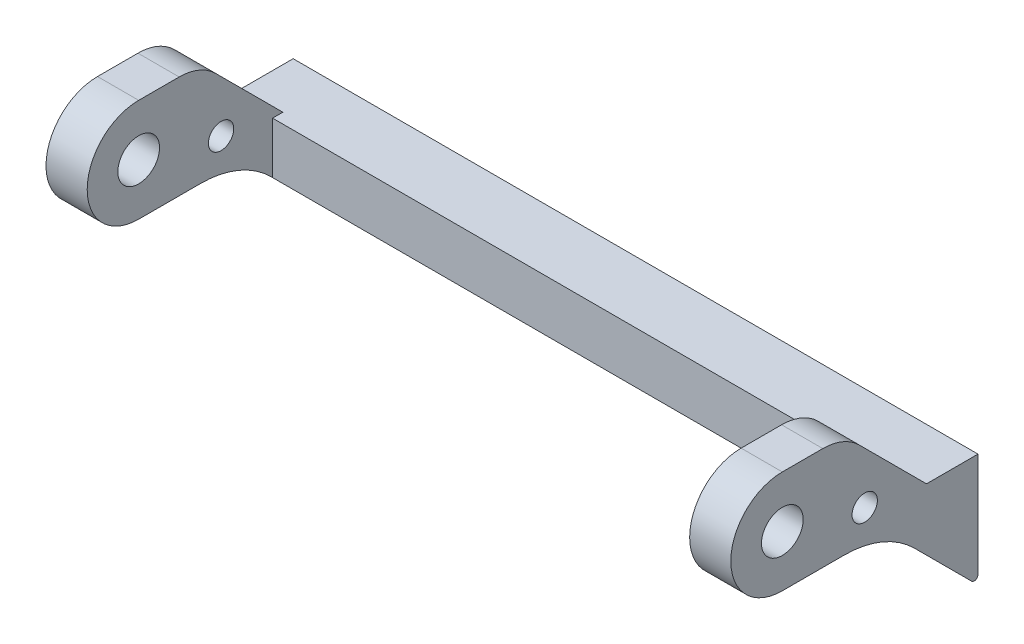
from build123d import *

# Parameters (mm, degrees)
SKETCH1_R           = 2.025
SKETCH1_R_2         = 1.2295
BOSS_EXTRUDE1_DEPTH = 4
BOSS_EXTRUDE3_START = 29.25
BOSS_EXTRUDE3_DEPTH = 29.25


with BuildPart() as part:
    # Sketch1 → Boss-Extrude1 (new body)
    with BuildSketch(Plane.YZ):
        with BuildLine():
            Line((-11.385441559, -10.385441559), (-5.828427125, -4.828427125))
            ThreePointArc((-5.828427125, -4.828427125), (-3.73508426, -1.69551813), (-3, 2))
            Line((-3, 2), (-3, 8))
            ThreePointArc((-3, 8), (2, 13), (7, 8))
            Line((7, 8), (7, 4.071067812))
            ThreePointArc((7, 4.071067812), (6.619397663, 2.15765065), (5.535533906, 0.535533906))
            Line((5.535533906, 0.535533906), (-1, -6))
            Line((-1, -6), (-1, -11))
            Line((-1, -11), (-11.130883118, -11))
            ThreePointArc((-11.130883118, -11), (-11.463479749, -10.777766036), (-11.385441559, -10.385441559))
        make_face()
        with Locations(Location((2, 8, 0), (0, 0, 270))):
            Circle(SKETCH1_R, mode=Mode.SUBTRACT)
        with Locations(Location((0, 0, 0), (0, 0, 270))):
            Circle(SKETCH1_R_2, mode=Mode.SUBTRACT)
    boss_extrude1 = extrude(amount=BOSS_EXTRUDE1_DEPTH)

    # Sketch4 → Boss-Extrude3 (add)
    with BuildSketch(Plane(origin=(0, 0, 0), x_dir=(0, -1, 0), z_dir=(-1, 0, 0)).offset(BOSS_EXTRUDE3_START)):
        with BuildLine():
            Line((1, -6), (1, -11))
            Line((1, -11), (11.130883118, -11))
            ThreePointArc((11.130883118, -11), (11.463479749, -10.777766036), (11.385441559, -10.385441559))
            Line((11.385441559, -10.385441559), (7, -6))
            Line((7, -6), (6, -5))
            Line((6, -5), (1, -5))
            Line((1, -5), (1, -6))
        make_face()
    boss_extrude3 = extrude(amount=-BOSS_EXTRUDE3_DEPTH)

    # Mirror8: Boss-Extrude3 across plane
    add(boss_extrude3.mirror(Plane(origin=(-29.25, 0, 0), x_dir=(0, 0, 1), z_dir=(1, 0, 0))))

    # Mirror9: Boss-Extrude1 across plane
    add(boss_extrude1.mirror(Plane(origin=(-29.25, 0, 0), x_dir=(0, 0, 1), z_dir=(1, 0, 0))))


solid = part.part
